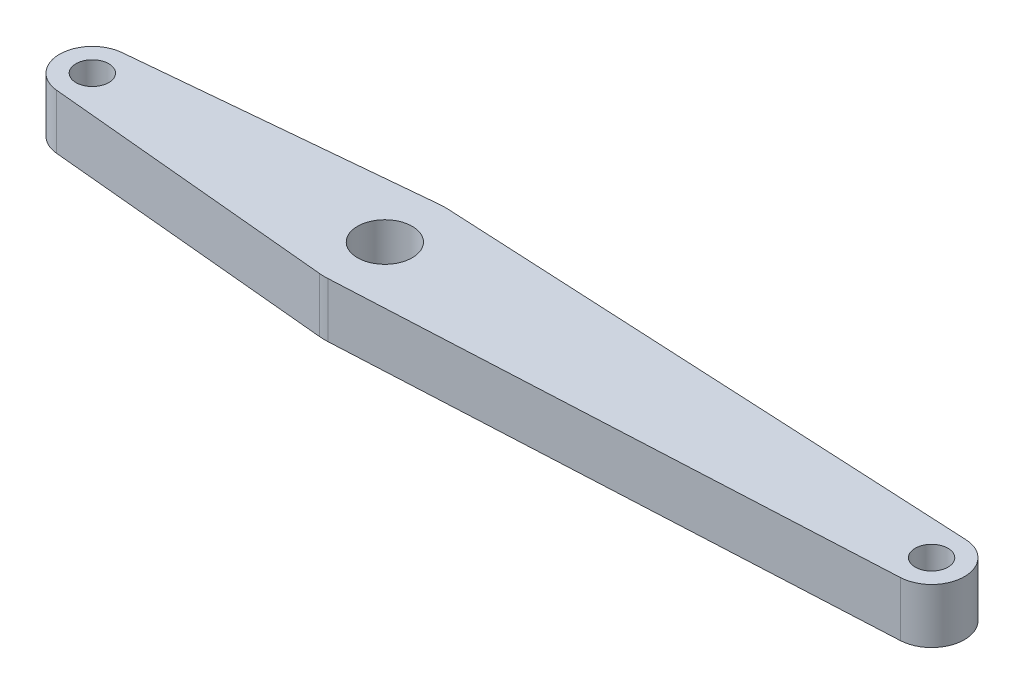
from build123d import *

# Parameters (mm, degrees)
SKETCH_1_R      = 3
SKETCH_1_R_2    = 5
EXTRUDE_1_DEPTH = 5


with BuildPart() as part:
    # 草图1 → 凸台-拉伸1 (new, symmetric)
    with BuildSketch(Plane(origin=(0, 0, 0), x_dir=(1, 0, 0), z_dir=(0, 1, 0))):
        with BuildLine():
            Line((-54.060747664, 5.97373937), (-1.028037383, 10.951855511))
            ThreePointArc((-1.028037383, 10.951855511), (-0.23963625, 10.997389439), (0.55, 10.986241395))
            Line((0.55, 10.986241395), (100.3, 5.992495307))
            ThreePointArc((100.3, 5.992495307), (106, 0), (100.3, -5.992495307))
            Line((100.3, -5.992495307), (0.55, -10.986241395))
            ThreePointArc((0.55, -10.986241395), (-0.23963625, -10.997389439), (-1.028037383, -10.951855511))
            Line((-1.028037383, -10.951855511), (-54.060747664, -5.97373937))
            ThreePointArc((-54.060747664, -5.97373937), (-59.5, 0), (-54.060747664, 5.97373937))
        make_face()
        with Locations(Location((-53.5, 0, 0), (0, 0, 270))):
            Circle(SKETCH_1_R, mode=Mode.SUBTRACT)
        with Locations(Location((100, 0, 0), (0, 0, 270))):
            Circle(SKETCH_1_R, mode=Mode.SUBTRACT)
        with Locations(Location((0, 0, 0), (0, 0, 270))):
            Circle(SKETCH_1_R_2, mode=Mode.SUBTRACT)
    extrude(amount=EXTRUDE_1_DEPTH, both=True)


solid = part.part
